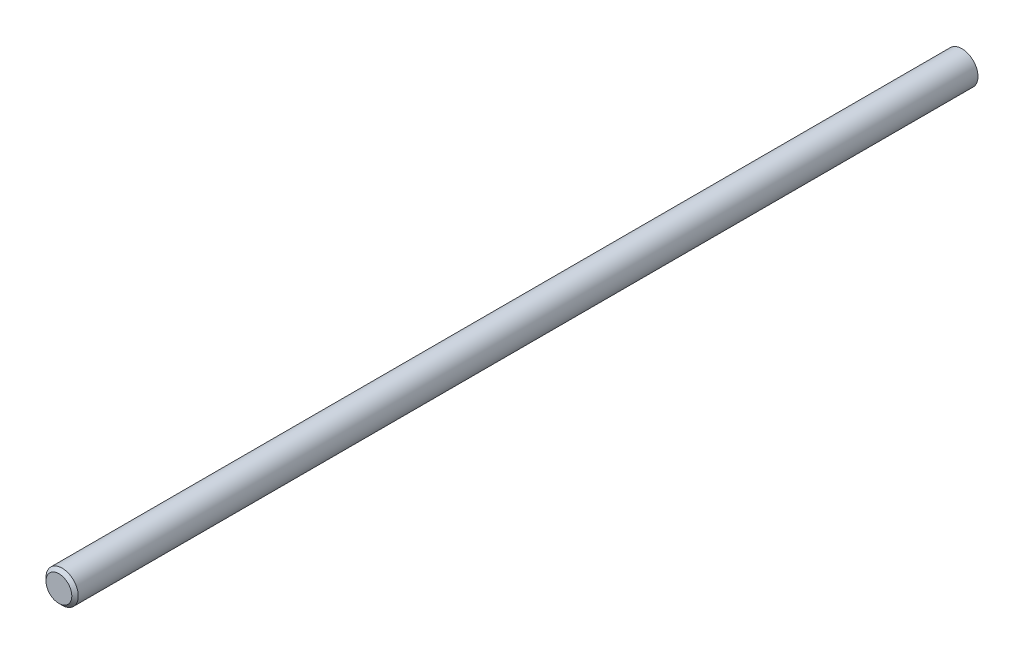
from build123d import *

# Parameters (mm, degrees)
ESQUISSE1_R        = 5
BOSS_EXTRU_1_DEPTH = 280
CHANFREIN1_SIZE    = 1


with BuildPart() as part:
    # Esquisse1 → Boss.-Extru.1 (new body)
    with BuildSketch(Plane.XY):
        Circle(ESQUISSE1_R)
    extrude(amount=BOSS_EXTRU_1_DEPTH)

    # Chanfrein1
    chanfrein1_edges = [part.edges().sort_by_distance(p)[0] for p in [
        (-5, 0, 280),
    ]]
    chamfer(chanfrein1_edges, length=CHANFREIN1_SIZE)


solid = part.part
